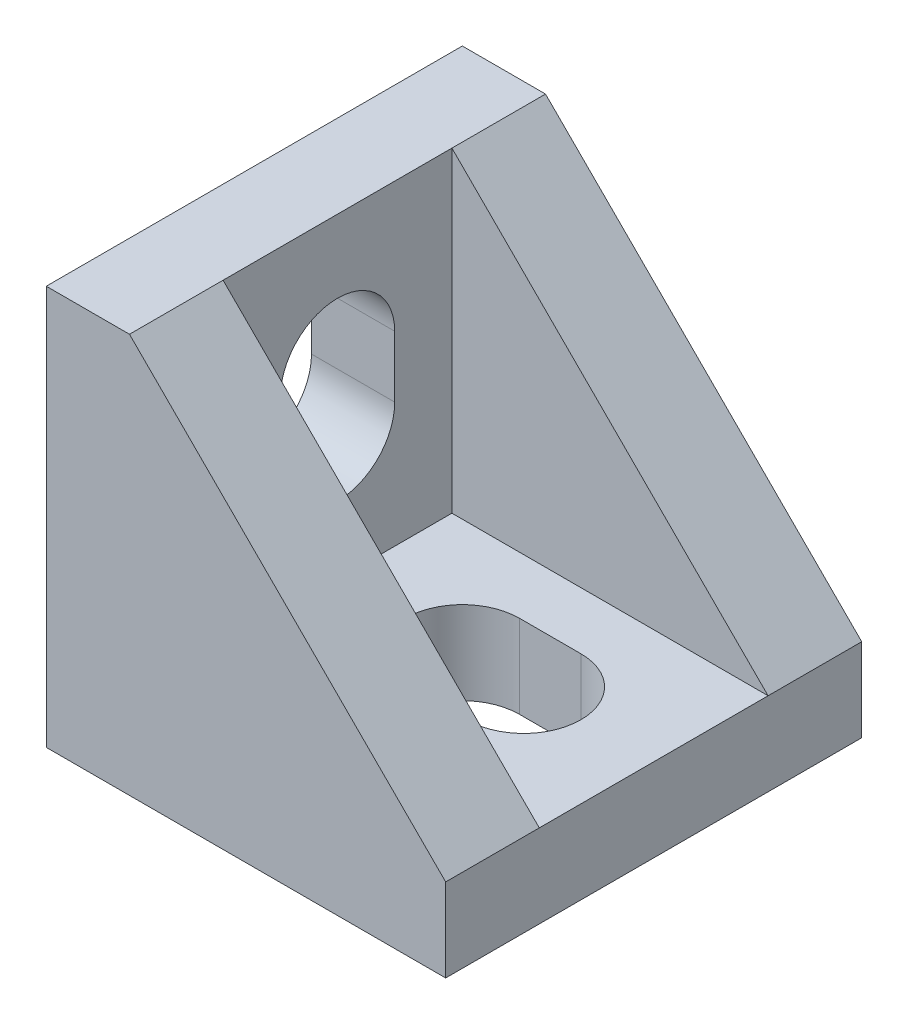
from build123d import *

# Parameters (mm, degrees)
BOSS_EXTRUDE1_DEPTH = 4.5
BOSS_EXTRUDE2_DEPTH = 4


with BuildPart() as part:
    # Sketch1 → Boss-Extrude1 (new body)
    with BuildSketch(Plane.XY):
        Polygon((0, 0), (0, 19.2), (4, 19.2), (11.6, 11.6), align=None)
    extrude(amount=BOSS_EXTRUDE1_DEPTH)

    # Sketch2 → Boss-Extrude2 (add)
    with BuildSketch(Plane(origin=(0, 0, 0), x_dir=(0, 0, -1), z_dir=(1, 0, 0))):
        with BuildLine():
            Line((-4.5, 19.2), (-10, 19.2))
            Line((-10, 19.2), (-10, 15.7))
            ThreePointArc((-10, 15.7), (-8.055456352, 14.894543648), (-7.25, 12.95))
            Line((-7.25, 12.95), (-7.25, 10))
            ThreePointArc((-7.25, 10), (-8.055456352, 8.055456352), (-10, 7.25))
            Line((-10, 7.25), (-10, 0))
            Line((-10, 0), (-4.5, 0))
            Line((-4.5, 0), (-4.5, 19.2))
        make_face()
    extrude(amount=BOSS_EXTRUDE2_DEPTH)

    # Mirror3: part across plane


with BuildPart() as part_1:
    add(part.part)
    add(part.part.mirror(Plane(origin=(4, 19.2, 10), x_dir=(1, 0, 0), z_dir=(0, 0, -1))))

    # Mirror4: part across plane


with BuildPart() as part_2:
    add(part_1.part)
    add(part_1.part.mirror(Plane(origin=(0, 0, 15.5), x_dir=(0, 0, 1), z_dir=(-0.7071067811865475, 0.7071067811865477, 0))))


solid = part_2.part
